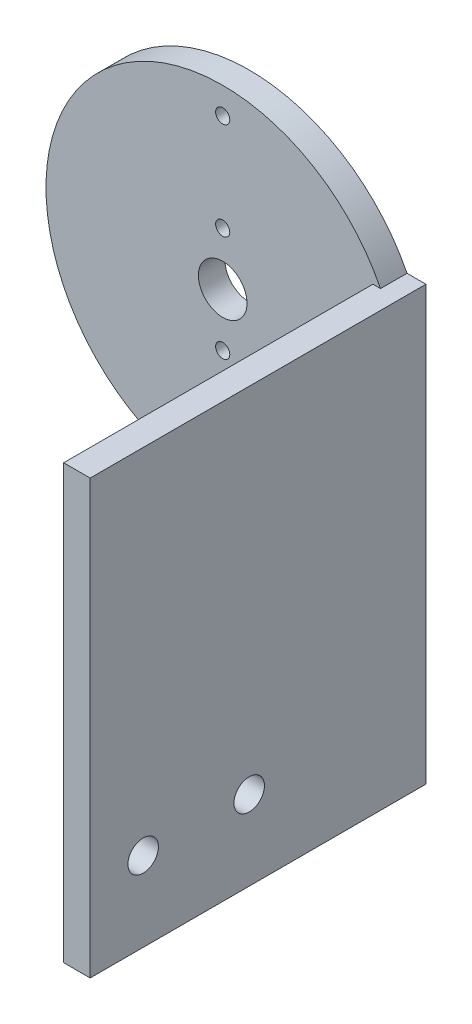
from build123d import *

# Parameters (mm, degrees)
BOSS_EXTRUDE1_START     = -26
SKETCH1_R               = 20
BOSS_EXTRUDE1_DEPTH     = 3
BOSS_EXTRUDE2_START     = -26
SKETCH2_W               = 20
SKETCH2_H               = 49
BOSS_EXTRUDE2_DEPTH     = 3
BOSS_EXTRUDE3_START     = -26
SKETCH3_W               = 3
SKETCH3_H               = 49
BOSS_EXTRUDE3_DEPTH     = 38
CUT_EXTRUDE1_DEPTH      = 52.730068626
CUT_EXTRUDE1_DEPTH_BACK = 52.730068626
SKETCH4_R               = 2.75
SKETCH4_R_2             = 0.8
CUT_EXTRUDE2_DEPTH      = 52.730068626
CUT_EXTRUDE2_DEPTH_BACK = 52.730068626
SKETCH5_R               = 1.725


with BuildPart() as part:
    # Sketch1 → Boss-Extrude1 (new body)
    with BuildSketch(Plane.XY.offset(BOSS_EXTRUDE1_START)):
        Circle(SKETCH1_R)
    extrude(amount=BOSS_EXTRUDE1_DEPTH)

    # Sketch2 → Boss-Extrude2 (add)
    with BuildSketch(Plane.XY.offset(BOSS_EXTRUDE2_START)):
        with Locations((10, -15.5)):
            Rectangle(SKETCH2_W, SKETCH2_H)
    extrude(amount=BOSS_EXTRUDE2_DEPTH)

    # Sketch3 → Boss-Extrude3 (add)
    with BuildSketch(Plane.XY.offset(BOSS_EXTRUDE3_START)):
        with Locations((18.5, -15.5)):
            Rectangle(SKETCH3_W, SKETCH3_H)
    extrude(amount=BOSS_EXTRUDE3_DEPTH)

    # Sketch4 → Cut-Extrude1 (cut, two sides: drawn at the far end of the back side and taken through both)
    with BuildSketch(Plane.XY.offset(-CUT_EXTRUDE1_DEPTH_BACK)):
        Circle(SKETCH4_R)
        with Locations((0, 6)):
            Circle(SKETCH4_R_2)
        with Locations((0, -6)):
            Circle(SKETCH4_R_2)
        with Locations((0, 17)):
            Circle(SKETCH4_R_2)
        with Locations((0, -17)):
            Circle(SKETCH4_R_2)
    extrude(amount=CUT_EXTRUDE1_DEPTH + CUT_EXTRUDE1_DEPTH_BACK, mode=Mode.SUBTRACT)

    # Sketch5 → Cut-Extrude2 (cut, two sides: drawn at the far end of the back side and taken through both)
    with BuildSketch(Plane(origin=(0, 0, 0), x_dir=(0, 0, -1), z_dir=(1, 0, 0)).offset(-CUT_EXTRUDE2_DEPTH_BACK)):
        with Locations((-6, -31)):
            Circle(SKETCH5_R)
        with Locations((6, -31)):
            Circle(SKETCH5_R)
    extrude(amount=CUT_EXTRUDE2_DEPTH + CUT_EXTRUDE2_DEPTH_BACK, mode=Mode.SUBTRACT)


solid = part.part
